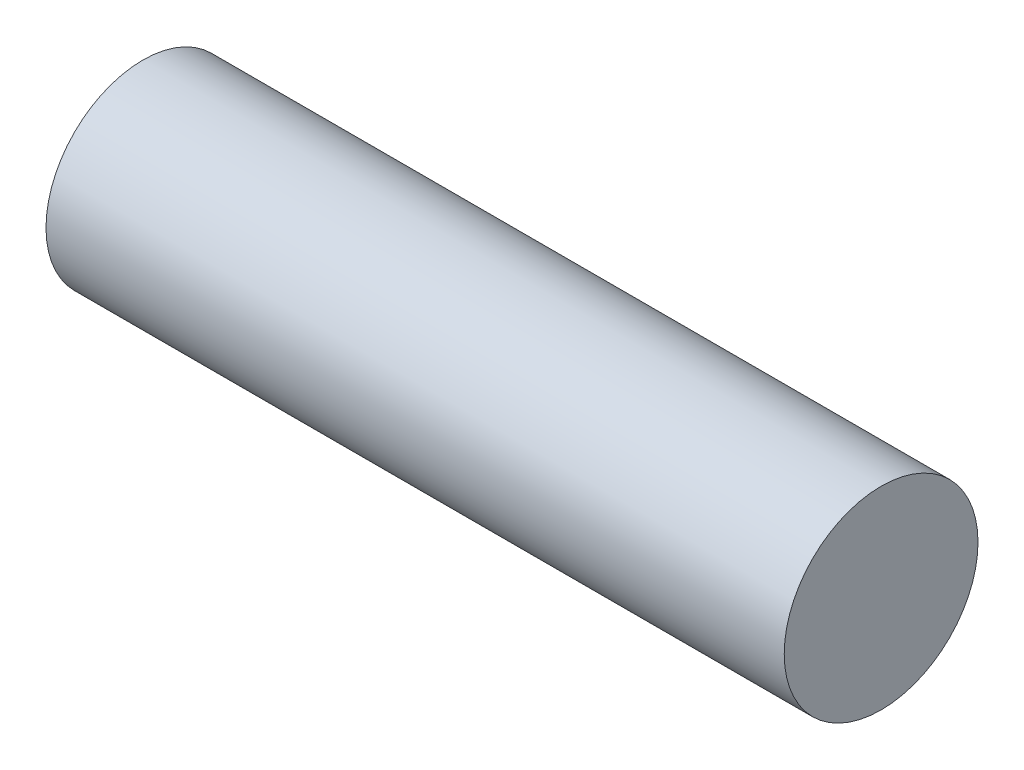
from build123d import *

# Parameters (mm, degrees)
SKETCH1_R           = 10.5
BOSS_EXTRUDE1_DEPTH = 40


with BuildPart() as part:
    # Sketch1 → Boss-Extrude1 (new, symmetric)
    with BuildSketch(Plane(origin=(0, 0, 0), x_dir=(0, 0, -1), z_dir=(1, 0, 0))):
        Circle(SKETCH1_R)
    extrude(amount=BOSS_EXTRUDE1_DEPTH, both=True)


solid = part.part
